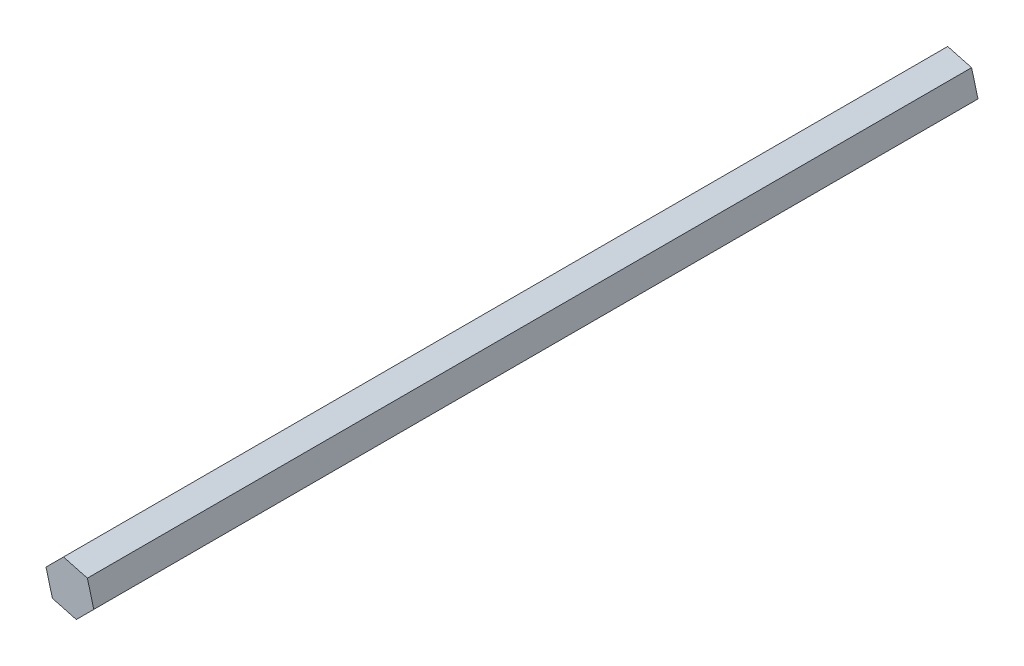
from build123d import *

# Parameters (mm, degrees)
BOSS_EXTRUDE1_DEPTH = 469.9


with BuildPart() as part:
    # Sketch1 → Boss-Extrude1 (new body)
    with BuildSketch(Plane.XY):
        Polygon((12.7, -3.402954744), (9.297045256, 9.297045256), (-3.402954744, 12.7), (-12.7, 3.402954744), (-9.297045256, -9.297045256), (3.402954744, -12.7), align=None)
    extrude(amount=BOSS_EXTRUDE1_DEPTH)


solid = part.part
